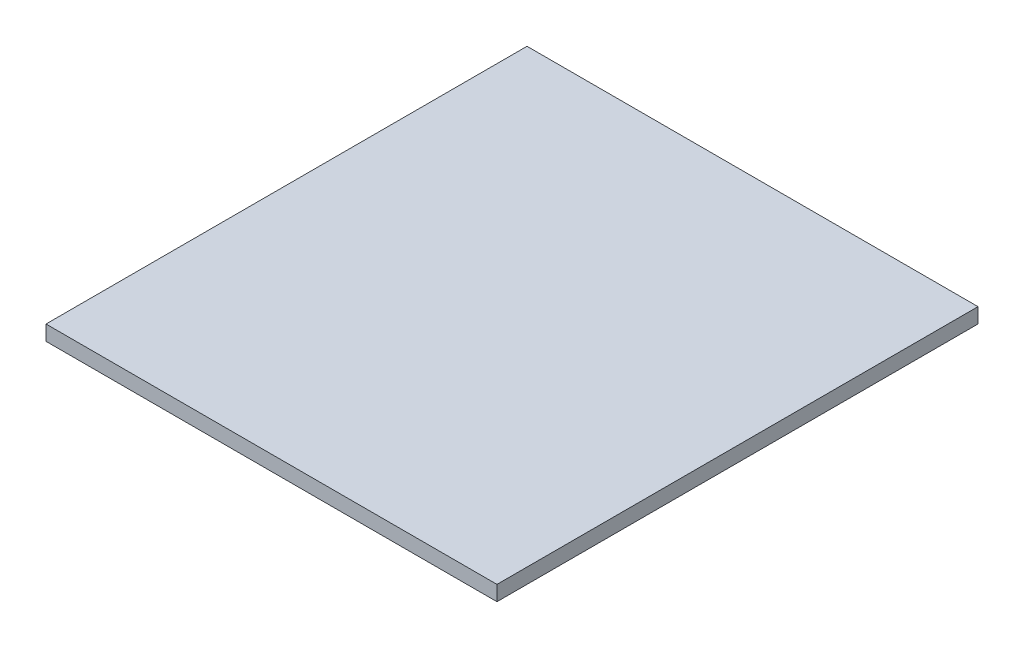
from build123d import *

# Parameters (mm, degrees)
SKETCH4_W           = 381
SKETCH4_H           = 406.4
BOSS_EXTRUDE1_DEPTH = 12.7


with BuildPart() as part:
    # Sketch1 → Loft1 section 0
    with BuildSketch(Plane(origin=(0, 0, 0), x_dir=(1, 0, 0), z_dir=(0, 1, 0))):
        with BuildLine():
            Line((-158.75, 165.1), (158.75, 165.1))
            Line((158.75, 165.1), (158.75, -165.1))
            Line((158.75, -165.1), (-158.75, -165.1))
            Line((-158.75, -165.1), (-158.75, 165.1))
        make_face()
    # Sketch2 → Loft1 section 1
    with BuildSketch(Plane(origin=(0, 25.4, 0), x_dir=(1, 0, 0), z_dir=(0, 1, 0))):
        with BuildLine():
            Line((-163.83, 176.53), (163.83, 176.53))
            Line((163.83, 176.53), (163.83, -176.53))
            Line((163.83, -176.53), (-163.83, -176.53))
            Line((-163.83, -176.53), (-163.83, 176.53))
        make_face()
    loft()

    # Sketch4 → Boss-Extrude1 (add)
    with BuildSketch(Plane(origin=(0, 25.4, 0), x_dir=(1, 0, 0), z_dir=(0, 1, 0))):
        Rectangle(SKETCH4_W, SKETCH4_H)
    extrude(amount=BOSS_EXTRUDE1_DEPTH)


solid = part.part
